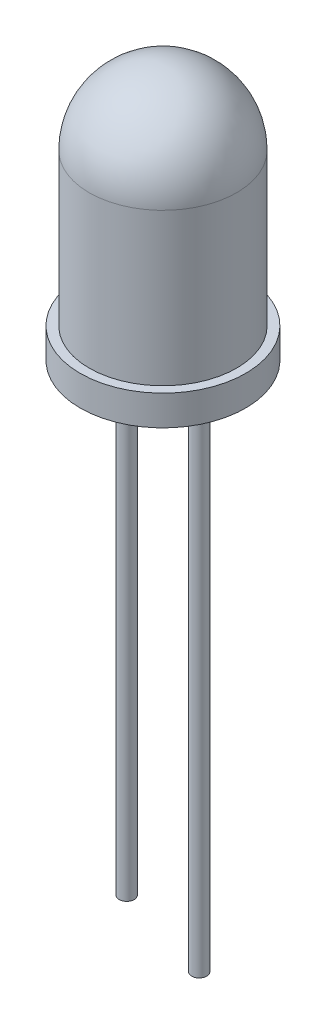
from build123d import *

# Parameters (mm, degrees)
CROQUIS1_R              = 2.75
SALIENTE_EXTRUIR1_DEPTH = 1
CROQUIS2_R              = 2.45
SALIENTE_EXTRUIR2_DEPTH = 5.05
C_PULA1_FACE_RADIUS     = 2.45
C_PULA1_HEIGHT          = 2.45
CROQUIS3_R              = 0.25
SALIENTE_EXTRUIR3_DEPTH = 16
CROQUIS5_R              = 0.25
SALIENTE_EXTRUIR5_DEPTH = 17


with BuildPart() as part:
    # Croquis1 → Saliente-Extruir1 (new body)
    with BuildSketch(Plane(origin=(0, 0, 0), x_dir=(1, 0, 0), z_dir=(0, 1, 0))):
        with Locations(Location((0, 0, 0), (0, 0, 270))):
            Circle(CROQUIS1_R)
    extrude(amount=SALIENTE_EXTRUIR1_DEPTH)

    # Croquis2 → Saliente-Extruir2 (add)
    with BuildSketch(Plane(origin=(0, 1, 0), x_dir=(1, 0, 0), z_dir=(0, 1, 0))):
        with Locations(Location((0, 0, 0), (0, 0, 270))):
            Circle(CROQUIS2_R)
    extrude(amount=SALIENTE_EXTRUIR2_DEPTH)

    # Cúpula1: a dome of height H over a round flat face of radius A is a cap of a sphere of radius (A * A + H * H) / (2 * H)
    c_pula1_r = (C_PULA1_FACE_RADIUS * C_PULA1_FACE_RADIUS + C_PULA1_HEIGHT * C_PULA1_HEIGHT) / (2 * C_PULA1_HEIGHT)
    c_pula1_base = Plane((0, 6.05, 0), z_dir=(0, 1, 0))
    with Locations(c_pula1_base.offset(C_PULA1_HEIGHT - c_pula1_r)):
        c_pula1_ball = Sphere(c_pula1_r, mode=Mode.PRIVATE)
    add(split(c_pula1_ball, bisect_by=c_pula1_base, keep=Keep.TOP, mode=Mode.PRIVATE))

    # Croquis3 → Saliente-Extruir3 (add)
    with BuildSketch(Plane.XZ):
        with Locations(Location((-1.205162028, 0, 0), (0, 0, 90))):
            Circle(CROQUIS3_R)
    extrude(amount=SALIENTE_EXTRUIR3_DEPTH)

    # Croquis5 → Saliente-Extruir5 (add)
    with BuildSketch(Plane.XZ):
        with Locations(Location((1.205162028, 0, 0), (0, 0, 90))):
            Circle(CROQUIS5_R)
    extrude(amount=SALIENTE_EXTRUIR5_DEPTH)


solid = part.part
